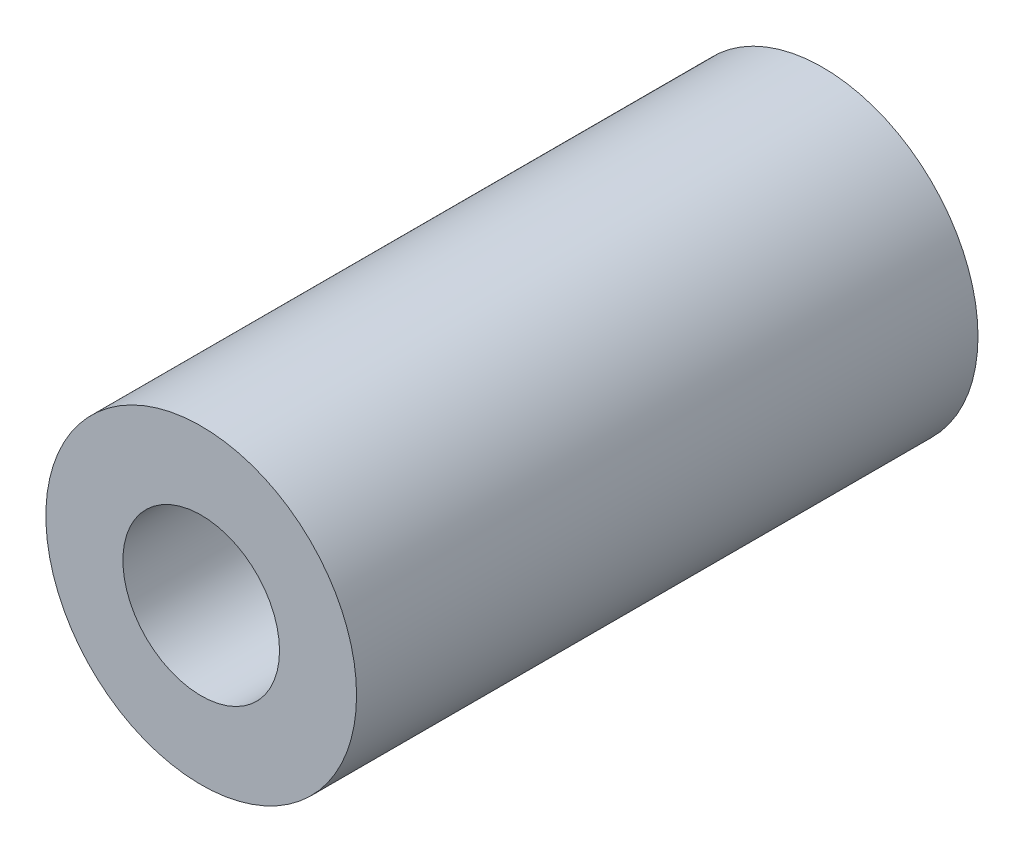
from build123d import *

# Parameters (mm, degrees)
SKETCH1_R      = 6.35
SKETCH1_R_2    = 3.2004
EXTRUDE1_DEPTH = 12.7


with BuildPart() as part:
    # Sketch1 → Extrude1 (new, symmetric)
    with BuildSketch(Plane.XY):
        Circle(SKETCH1_R)
        Circle(SKETCH1_R_2, mode=Mode.SUBTRACT)
    extrude(amount=EXTRUDE1_DEPTH, both=True)


solid = part.part
